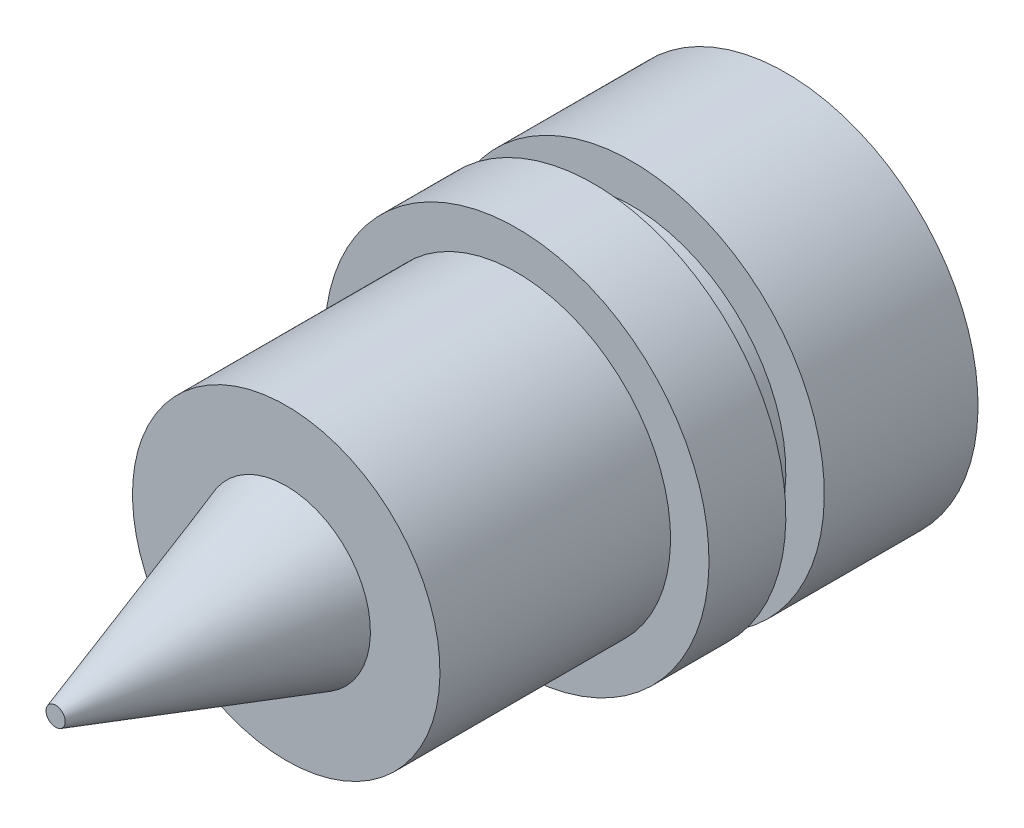
from build123d import *

# Parameters (mm, degrees)
CROQUIS4_W            = 3.5
CROQUIS4_H            = 1
CORTAR_EXTRUIR1_DEPTH = 1


with BuildPart() as part:
    # Croquis3 → Revolución1 (revolve)
    with BuildSketch(Plane(origin=(0, 0, 0), x_dir=(0, 0, -1), z_dir=(1, 0, 0)), mode=Mode.PRIVATE) as revoluci_n1_sk:
        Polygon((0, 0), (0, 2.5), (-2, 2.5), (-2, 2), (-2.5, 2), (-2.5, 2.5), (-3.5, 2.5), (-3.5, 2), (-6.5, 2), (-6.5, 1.095516127), (-9.5, 0.125), (-9.5, 0), align=None)
    revolve(revoluci_n1_sk.sketch.rotate(Axis((0, 0, 9.5), (0, 0, -1)), 180), axis=Axis((0, 0, 9.5), (0, 0, -1)))

    # Croquis4 → Cortar-Extruir1 (cut)
    with BuildSketch(Plane(origin=(0, 0, 0), x_dir=(-1, 0, 0), z_dir=(0, 0, -1))):
        Rectangle(CROQUIS4_W, CROQUIS4_H)
    extrude(amount=-CORTAR_EXTRUIR1_DEPTH, mode=Mode.SUBTRACT)


solid = part.part
